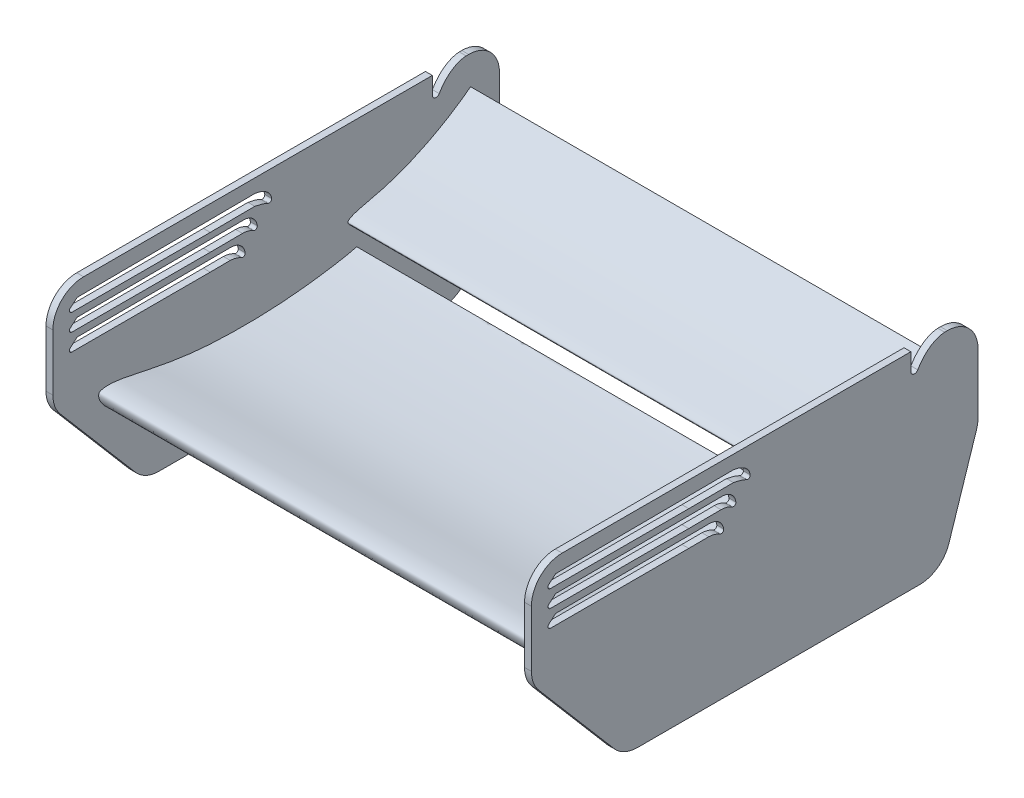
from build123d import *

# Parameters (mm, degrees)
EXTRUDED_AIRFOILS_DEPTH   = 487.449999952
EXTRUDED_AIRFOILS_2_DEPTH = 487.449999952
EXTRUDED_ENDPLATE_DEPTH   = 14.200000048
CUT_EXTRUDE1_DEPTH        = 1952.790306669
CUT_EXTRUDE1_DEPTH_BACK   = 1952.790306669


with BuildPart() as part:
    # Airfoils Sketch → Extruded Airfoils (new body)
    with BuildSketch(Plane(origin=(0, 0, 0), x_dir=(0, 0, -1), z_dir=(1, 0, 0))):
        with BuildLine():
            add(Edge.make_bspline(
                [(897.989632302, 946.000000046), (898.000513914, 945.951839281), (894.184279323, 944.352851316), (890.699819702, 942.296180156), (882.791939538, 937.933635623), (873.645939793, 932.954112993), (861.849234489, 927.640797519), (847.825954561, 922.30857822), (831.530849272, 916.634932924), (813.2008765, 910.647350929), (793.094311676, 904.422943815), (771.513904823, 898.06413618), (748.758616882, 891.715468852), (725.138031005, 885.514054628), (700.954405569, 879.629236447), (676.498467134, 874.257660211), (652.057841056, 869.565934163), (627.831804234, 865.795405193), (603.922786486, 863.282964935), (580.420628735, 862.073173574), (557.409835441, 862.139402028), (535.014387038, 863.428748658), (513.364868859, 865.878949834), (492.614715532, 869.402461043), (472.917623861, 873.841507376), (454.449730598, 879.083530955), (437.385501316, 885.029883679), (421.874189905, 891.561628897), (408.048549489, 898.559233256), (396.013645082, 905.891109977), (385.858554918, 913.416953036), (377.637446771, 920.978739297), (371.3813299, 928.395891647), (367.105151877, 935.48676691), (364.93961271, 941.592944474), (364.478646936, 945.808092476), (364.72423345, 948.022458751), (364.958745374, 949.103505513), (365.207345688, 949.805698607), (365.433998761, 950.327271857), (365.635213878, 950.682005569), (365.862098213, 951.012091726), (366.146275406, 951.304038649), (366.468830129, 951.577773117), (366.958374644, 951.951982083), (367.677617136, 952.372493507), (368.829149529, 952.929808373), (370.247862327, 953.455636597), (373.990203501, 954.551133318), (380.956406634, 955.316418787), (391.975654885, 955.164476466), (405.835940211, 953.699088451), (422.612261866, 950.928158747), (442.470944413, 946.830199159), (465.539283336, 941.749563758), (491.828789906, 936.399518652), (521.027342465, 931.264471412), (552.59555029, 926.799070536), (585.816105194, 923.592309215), (619.824369214, 921.766444825), (653.851796059, 920.998850705), (687.331665883, 921.160230805), (719.756890506, 922.202805035), (750.588370802, 924.122270917), (779.304150897, 926.732212739), (805.469395405, 929.729342209), (828.782042195, 932.897265457), (848.904387076, 936.025543084), (865.887900109, 938.991006858), (878.885329483, 941.41974614), (889.414050412, 943.814205441), (893.791195704, 944.72287816), (897.978579692, 946.048917629), (897.989632302, 946.000000046)],
                knots=[0, 0, 0, 0, 0.001812691, 0.006911328, 0.014576348, 0.024172143, 0.035572242, 0.04901308, 0.064512615, 0.081849281, 0.100772139, 0.120997345, 0.142228397, 0.164173399, 0.186536734, 0.209022727, 0.231367049, 0.253319655, 0.274803883, 0.295858285, 0.316448578, 0.336530716, 0.35603337, 0.374893008, 0.392989986, 0.410197087, 0.426388181, 0.441458696, 0.455334222, 0.467938119, 0.479235883, 0.48920359, 0.497850586, 0.505193934, 0.511308341, 0.515097163, 0.516441428, 0.517272652, 0.518060388, 0.518436362, 0.518797413, 0.519153544, 0.519507976, 0.519886846, 0.520288641, 0.521160208, 0.522116283, 0.523720315, 0.52521352, 0.532574604, 0.542380648, 0.554776211, 0.56993128, 0.588004893, 0.609187965, 0.63332852, 0.660001247, 0.688743434, 0.718873444, 0.749542513, 0.780126844, 0.81020899, 0.839387288, 0.867183376, 0.893104481, 0.916760447, 0.937874173, 0.956198632, 0.971543675, 0.983762849, 0.992691516, 0.998158824, 1, 1, 1, 1], degree=3))
        make_face()
    extrude(amount=EXTRUDED_AIRFOILS_DEPTH)



with BuildPart() as body_2:
    # Airfoils Sketch → Extruded Airfoils 2 (new body)
    with BuildSketch(Plane(origin=(0, 0, 0), x_dir=(0, 0, -1), z_dir=(1, 0, 0))):
        with BuildLine():
            add(Edge.make_bspline(
                [(1133.247895197, 1114.879542376), (1133.263722473, 1114.859087767), (1131.806001628, 1113.25519051), (1130.607103196, 1111.507461609), (1127.818717185, 1107.685840221), (1124.579136733, 1103.297234833), (1120.155072018, 1098.163376496), (1114.678164398, 1092.527643798), (1108.198329078, 1086.226907711), (1100.821972353, 1079.326674016), (1092.654635701, 1071.920724909), (1083.817370556, 1064.12470491), (1074.420106224, 1056.073413691), (1064.579459073, 1047.900476053), (1054.401433329, 1039.753195997), (1043.980514589, 1031.789286322), (1033.416365688, 1024.151513447), (1022.750162563, 1016.998566842), (1011.955953794, 1010.513055004), (1001.066525449, 1004.736020325), (990.127889471, 999.673527988), (979.210614335, 995.327909586), (968.390476554, 991.698514411), (957.759696413, 988.777748272), (947.426165666, 986.524734356), (937.498419283, 984.925029416), (928.081119643, 983.970423676), (919.271451623, 983.63749458), (911.158898739, 983.898883494), (903.822468342, 984.715380277), (897.33550853, 986.040096456), (891.758716327, 987.81000449), (887.146787462, 989.946243092), (883.547028652, 992.365889283), (881.167242998, 994.785302552), (880.015293983, 996.684326263), (879.641684401, 997.789924081), (879.513701957, 998.355046525), (879.476275125, 998.743433531), (879.468413302, 999.041215906), (879.485408764, 999.254162868), (879.520046508, 999.461091263), (879.59032598, 999.662596722), (879.682856237, 999.863951825), (879.832419813, 1000.149972229), (880.080778475, 1000.5088225), (880.504074889, 1001.028314482), (881.061180809, 1001.592004847), (882.595280633, 1002.940520477), (885.732952339, 1004.845945107), (890.997784961, 1007.213160315), (897.902110048, 1009.585764522), (906.479782474, 1011.984112713), (916.814518812, 1014.434823253), (928.890520217, 1017.129551851), (942.5553547, 1020.409457485), (957.553613901, 1024.435409414), (973.528585227, 1029.303838406), (990.009352771, 1035.135567193), (1006.558380368, 1041.797229165), (1022.882234338, 1048.96552869), (1038.740496723, 1056.453629105), (1053.903013356, 1064.126592787), (1068.114808727, 1071.863036041), (1081.169360459, 1079.458915104), (1092.927377374, 1086.673988972), (1103.293364143, 1093.338660471), (1112.153586842, 1099.278269075), (1119.55974592, 1104.445736805), (1125.192396428, 1108.475998694), (1129.660659044, 1111.943485137), (1131.537478613, 1113.343836836), (1133.231819204, 1114.900318417), (1133.247895197, 1114.879542376)],
                knots=[0, 0, 0, 0, 0.001812691, 0.006911328, 0.014576348, 0.024172143, 0.035572242, 0.04901308, 0.064512615, 0.081849281, 0.100772139, 0.120997345, 0.142228397, 0.164173399, 0.186536734, 0.209022727, 0.231367049, 0.253319655, 0.274803883, 0.295858285, 0.316448578, 0.336530716, 0.35603337, 0.374893008, 0.392989986, 0.410197087, 0.426388181, 0.441458696, 0.455334222, 0.467938119, 0.479235883, 0.48920359, 0.497850586, 0.505193934, 0.511308341, 0.515097163, 0.516441428, 0.517272652, 0.518060388, 0.518436362, 0.518797413, 0.519153544, 0.519507976, 0.519886846, 0.520288641, 0.521160208, 0.522116283, 0.523720315, 0.52521352, 0.532574604, 0.542380648, 0.554776211, 0.56993128, 0.588004893, 0.609187965, 0.63332852, 0.660001247, 0.688743434, 0.718873444, 0.749542513, 0.780126844, 0.81020899, 0.839387288, 0.867183376, 0.893104481, 0.916760447, 0.937874173, 0.956198632, 0.971543675, 0.983762849, 0.992691516, 0.998158824, 1, 1, 1, 1], degree=3))
        make_face()
    extrude(amount=EXTRUDED_AIRFOILS_2_DEPTH)


with BuildPart() as part_1:
    add(part.part)

    add(body_2.part)  # Extruded Endplate merges body 2
    # Endplate Sketch → Extruded Endplate (add)
    with BuildSketch(Plane(origin=(501.65, 0, 0), x_dir=(0, 0, -1), z_dir=(1, 0, 0))):
        with BuildLine():
            Line((333.44768579, 1174.600000046), (1129.475, 1174.600000046))
            ThreePointArc((1129.475, 1174.600000046), (1174.376280605, 1156.001280651), (1192.975, 1111.100000046))
            Line((1192.975, 1111.100000046), (1192.975, 986.671665425))
            ThreePointArc((1192.975, 986.671665425), (1192.187961727, 976.704999408), (1189.846356489, 966.985393159))
            Line((1189.846356489, 966.985393159), (1132.89690026, 792.340042461))
            ThreePointArc((1132.89690026, 792.340042461), (1109.822807151, 760.634057096), (1072.525543772, 748.526314727))
            Line((1072.525543772, 748.526314727), (489.177152122, 748.526314727))
            ThreePointArc((489.177152122, 748.526314727), (462.584654451, 754.362729445), (440.880498348, 770.799099999))
            Line((440.880498348, 770.799099999), (285.151032016, 953.232285636))
            ThreePointArc((285.151032016, 953.232285636), (273.869638177, 972.488923615), (269.94768579, 994.459500364))
            Line((269.94768579, 994.459500364), (269.94768579, 1111.100000046))
            ThreePointArc((269.94768579, 1111.100000046), (288.546405185, 1156.001280651), (333.44768579, 1174.600000046))
        make_face()
    extrude(amount=-EXTRUDED_ENDPLATE_DEPTH)

    # Mirror 2: part across plane


with BuildPart() as part_2:
    add(part_1.part)
    add(part_1.part.mirror(Plane(origin=(0, 0, 0), x_dir=(0, 0, 1), z_dir=(1, 0, 0))))

    # Sketch1 → Cut-Extrude1 (cut, two sides: drawn at the far end of the back side and taken through both)
    with BuildSketch(Plane(origin=(501.65, 0, 0), x_dir=(0, 0, -1), z_dir=(1, 0, 0)).offset(-CUT_EXTRUDE1_DEPTH_BACK)):
        with BuildLine():
            Line((320.017408633, 1144.292412319), (687.301408633, 1146.60679947))
            add(Edge.make_bspline(
                [(687.301408633, 1146.60679947), (701.969177343, 1144.720446019), (719.675690048, 1137.230509322), (722.057020075, 1120.557540088)],
                knots=[0, 0, 0, 0, 0.846941723, 0.846941723, 0.846941723, 0.846941723], degree=3))
            ThreePointArc((722.057020075, 1120.557540088), (719.972596187, 1115.699699892), (714.699792475, 1115.324233071))
            add(Edge.make_bspline(
                [(687.301411493, 1123.746345641), (699.222179886, 1121.159298956), (705.616828783, 1120.00802663), (714.699792475, 1115.324233071)],
                knots=[0, 0, 0, 0, 0.774369871, 0.774369871, 0.774369871, 0.774369871], degree=3))
            Line((687.301411493, 1123.746345641), (595.227728293, 1123.166156606))
            Line((595.227728293, 1123.166156606), (309.141173575, 1123.166156606))
            ThreePointArc((309.141173575, 1123.166156606), (304.37789974, 1126.480477593), (305.829987495, 1132.098746222))
            Line((305.829987495, 1132.098746222), (320.017408633, 1144.292412319))
        make_face()
        with BuildLine():
            Line((320.018421601, 1108.731712717), (661.902421601, 1110.886045432))
            add(Edge.make_bspline(
                [(661.902421601, 1110.886045432), (678.835792925, 1111.507486655), (690.229734492, 1101.096332689), (692.44680598, 1086.548335608)],
                knots=[0, 0, 0, 0, 0.809070721, 0.809070721, 0.809070721, 0.809070721], degree=3))
            ThreePointArc((692.44680598, 1086.548335608), (690.218008539, 1081.539844812), (684.736402528, 1081.472661316))
            add(Edge.make_bspline(
                [(661.902424461, 1088.025591602), (669.897528191, 1087.992534936), (677.988465911, 1085.681398392), (684.736402528, 1081.472661316)],
                knots=[0, 0, 0, 0, 0.706874062, 0.706874062, 0.706874062, 0.706874062], degree=3))
            Line((661.902424461, 1088.025591602), (595.196446196, 1087.605253502))
            Line((595.196446196, 1087.605253502), (309.141949766, 1087.605253502))
            ThreePointArc((309.141949766, 1087.605253502), (304.378675932, 1090.919574489), (305.830763687, 1096.537843117))
            Line((305.830763687, 1096.537843117), (320.018421601, 1108.731712717))
        make_face()
        with BuildLine():
            Line((320.01943457, 1073.171013115), (636.50343457, 1075.165291393))
            add(Edge.make_bspline(
                [(636.50343457, 1075.165291393), (653.134432042, 1075.427100872), (664.832950936, 1065.465400446), (667.326709282, 1050.853230969)],
                knots=[0, 0, 0, 0, 0.816938356, 0.816938356, 0.816938356, 0.816938356], degree=3))
            ThreePointArc((667.326709282, 1050.853230969), (665.24025393, 1045.842499648), (659.819006487, 1045.57641607))
            add(Edge.make_bspline(
                [(636.50343743, 1052.304837564), (644.681448106, 1051.937288932), (652.748596693, 1049.573692273), (659.819006487, 1045.57641607)],
                knots=[0, 0, 0, 0, 0.717847304, 0.717847304, 0.717847304, 0.717847304], degree=3))
            Line((636.50343743, 1052.304837564), (595.1651641, 1052.044350397))
            Line((595.1651641, 1052.044350397), (309.142725958, 1052.044350397))
            ThreePointArc((309.142725958, 1052.044350397), (304.379452123, 1055.358671384), (305.831539878, 1060.976940012))
            Line((305.831539878, 1060.976940012), (320.01943457, 1073.171013115))
        make_face()
        with BuildLine():
            Line((1054.253455339, 1174.600000046), (1054.253455339, 1138.878872305))
            ThreePointArc((1054.253455339, 1138.878872305), (1059.881147224, 1131.523934619), (1068.451646513, 1135.032861272))
            add(Edge.make_bspline(
                [(1068.451646513, 1135.032861272), (1080.101142211, 1154.958079663), (1099.217233237, 1172.762613661), (1124.124981403, 1174.600000046)],
                knots=[0.266303597, 0.266303597, 0.266303597, 0.266303597, 1, 1, 1, 1], degree=3))
            Line((1124.124981403, 1174.600000046), (1054.253455339, 1174.600000046))
        make_face()
    extrude(amount=CUT_EXTRUDE1_DEPTH + CUT_EXTRUDE1_DEPTH_BACK, mode=Mode.SUBTRACT)


solid = part_2.part
